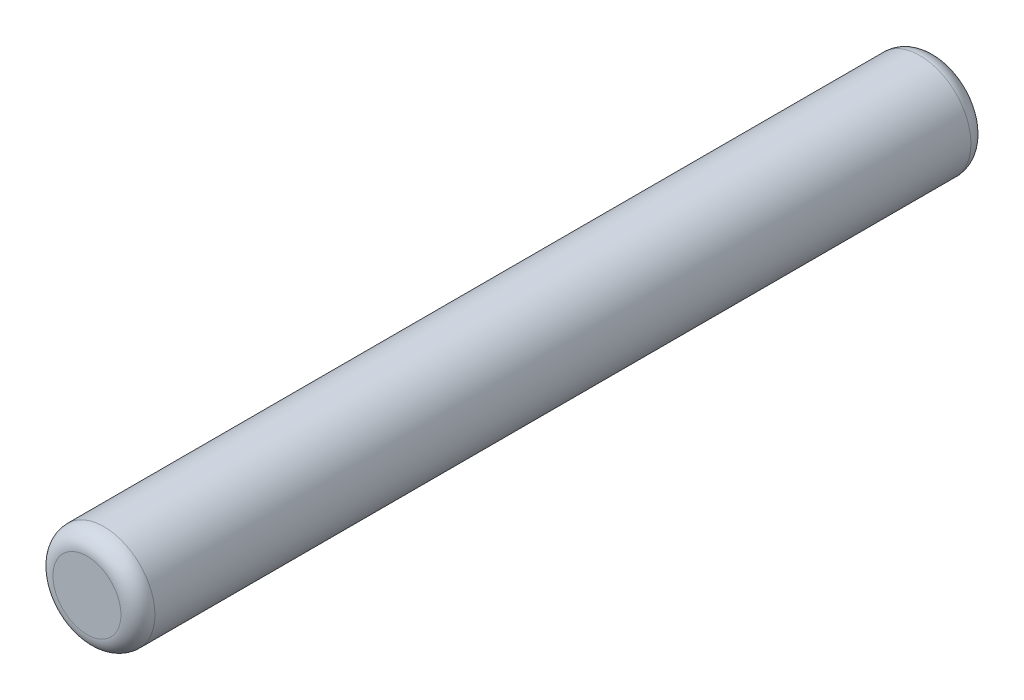
from build123d import *

# Parameters (mm, degrees)
SKETCH_1_R      = 1.5
EXTRUDE_1_DEPTH = 12.5
FILLET_1_R      = 0.5


with BuildPart() as part:
    # ｽｹｯﾁ1 → ﾎﾞｽ - 押し出し1 (new, symmetric)
    with BuildSketch(Plane.XY):
        Circle(SKETCH_1_R)
    extrude(amount=EXTRUDE_1_DEPTH, both=True)

    # ﾌｨﾚｯﾄ1
    fillet_1_edges = [part.edges().sort_by_distance(p)[0] for p in [
        (-1.5, 0, -12.5),
        (-1.5, 0, 12.5),
    ]]
    fillet(fillet_1_edges, radius=FILLET_1_R)


solid = part.part
